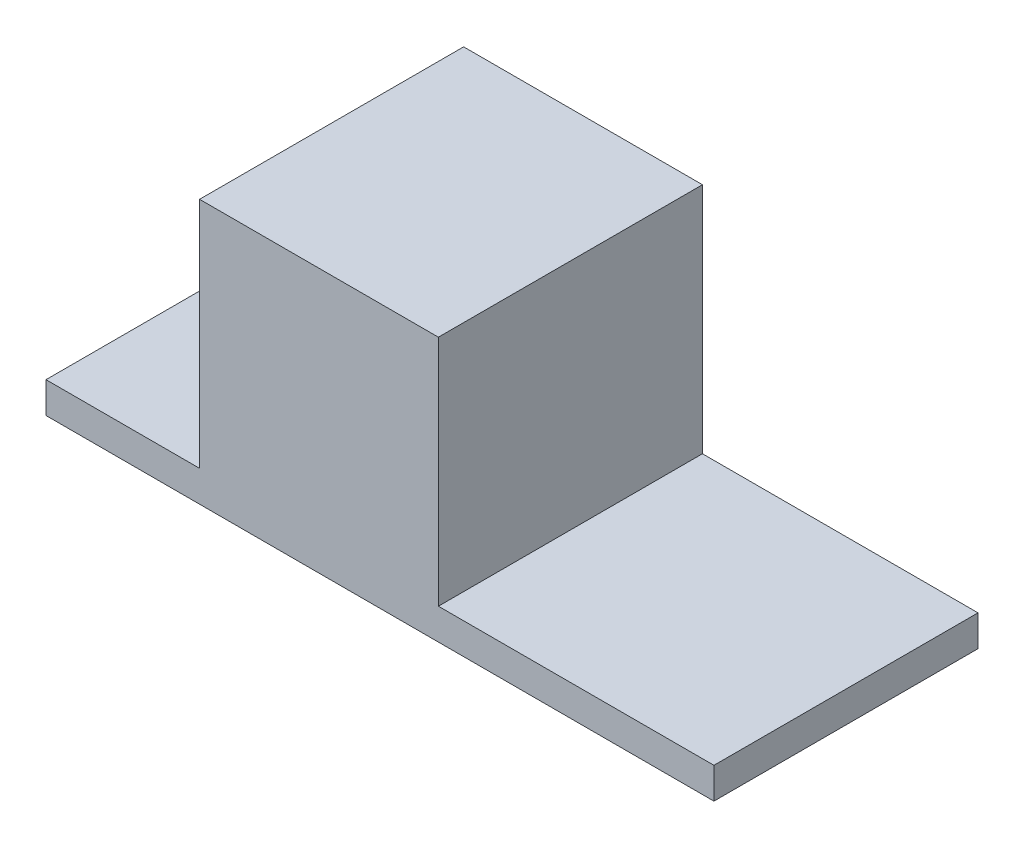
from build123d import *

# Parameters (mm, degrees)
SKETCH1_W           = 43
SKETCH1_H           = 17
BOSS_EXTRUDE1_DEPTH = 2
SKETCH2_W           = 15.374396347
SKETCH2_H           = 17
BOSS_EXTRUDE2_DEPTH = 15


with BuildPart() as part:
    # Sketch1 → Boss-Extrude1 (new body)
    with BuildSketch(Plane(origin=(0, 0, 0), x_dir=(1, 0, 0), z_dir=(0, 1, 0))):
        with Locations((21.5, -8.5)):
            Rectangle(SKETCH1_W, SKETCH1_H)
    extrude(amount=BOSS_EXTRUDE1_DEPTH)

    # Sketch2 → Boss-Extrude2 (add)
    with BuildSketch(Plane(origin=(0, 2, 0), x_dir=(1, 0, 0), z_dir=(0, 1, 0))):
        with Locations((17.574304623, -8.5)):
            Rectangle(SKETCH2_W, SKETCH2_H)
    extrude(amount=BOSS_EXTRUDE2_DEPTH)


solid = part.part
